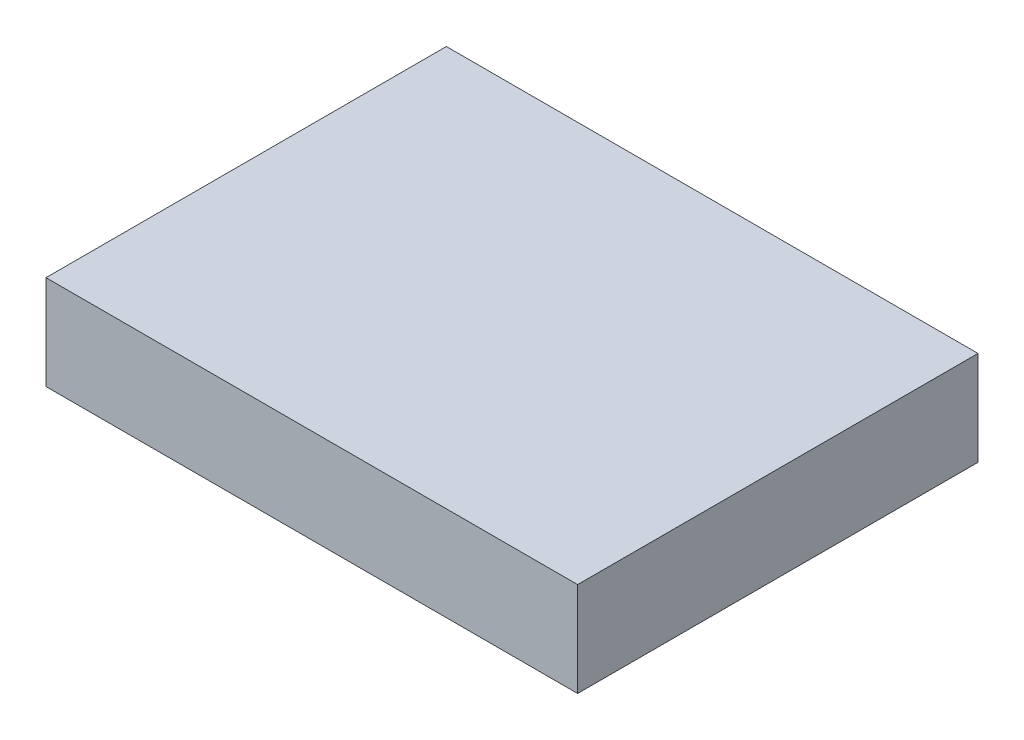
from build123d import *

# Parameters (mm, degrees)
SKETCH1_W           = 90.185852982
SKETCH1_H           = 67.921220527
BOSS_EXTRUDE1_DEPTH = 16


with BuildPart() as part:
    # Sketch1 → Boss-Extrude1 (new body)
    with BuildSketch(Plane(origin=(0, 0, 0), x_dir=(1, 0, 0), z_dir=(0, 1, 0))):
        with Locations((71.585020804, -2.11373093)):
            Rectangle(SKETCH1_W, SKETCH1_H)
    extrude(amount=BOSS_EXTRUDE1_DEPTH)


solid = part.part
